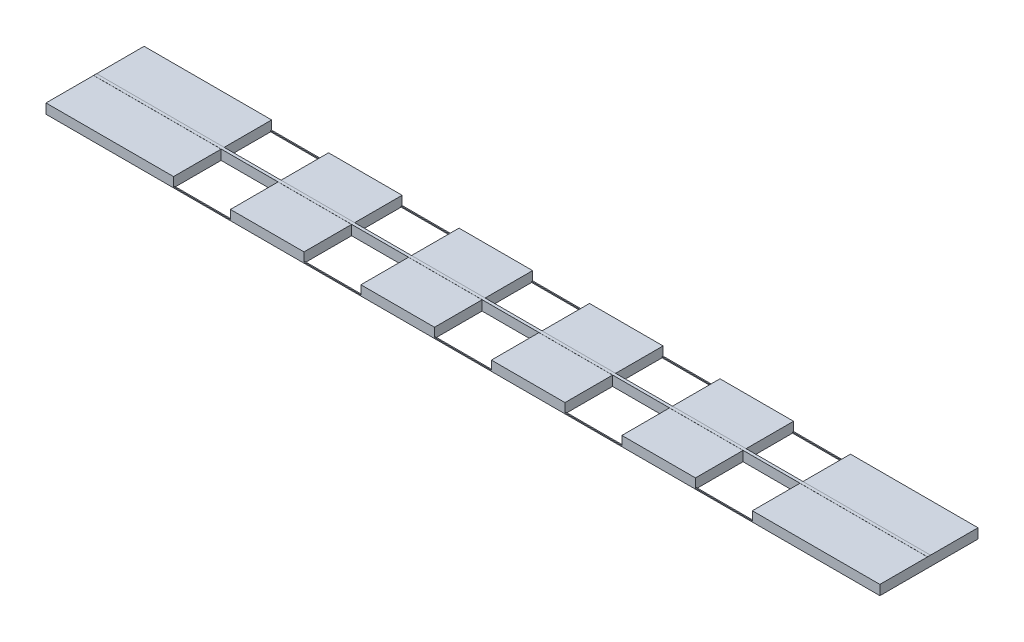
from build123d import *

# Parameters (mm, degrees)
SKETCH1_W           = 8500
SKETCH1_H           = 1000
BOSS_EXTRUDE1_DEPTH = 100
SKETCH2_W           = 8500
SKETCH2_H           = 30
BOSS_EXTRUDE2_DEPTH = 1
SKETCH3_W           = 580
SKETCH3_H           = 475
CUT_EXTRUDE2_DEPTH  = 4281.478945165
SKETCH4_W           = 580
SKETCH4_H           = 10
CUT_EXTRUDE3_DEPTH  = 90


with BuildPart() as part:
    # Sketch1 → Boss-Extrude1 (new body)
    with BuildSketch(Plane(origin=(0, 0, 0), x_dir=(1, 0, 0), z_dir=(0, 1, 0))):
        Rectangle(SKETCH1_W, SKETCH1_H)
    extrude(amount=BOSS_EXTRUDE1_DEPTH)

    # Sketch3 → Cut-Extrude2 (cut, through all)
    with BuildSketch(Plane(origin=(0, 100, 0), x_dir=(1, 0, 0), z_dir=(0, 1, 0))):
        with Locations((-2660, 252.5)):
            Rectangle(SKETCH3_W, SKETCH3_H)
        with Locations((-1330, 252.5)):
            Rectangle(SKETCH3_W, SKETCH3_H)
        with Locations((0, 252.5)):
            Rectangle(SKETCH3_W, SKETCH3_H)
        with Locations((1330, 252.5)):
            Rectangle(SKETCH3_W, SKETCH3_H)
        with Locations((2660, 252.5)):
            Rectangle(SKETCH3_W, SKETCH3_H)
        with Locations((-1330, -252.5)):
            Rectangle(SKETCH3_W, SKETCH3_H)
        with Locations((0, -252.5)):
            Rectangle(SKETCH3_W, SKETCH3_H)
        with Locations((1330, -252.5)):
            Rectangle(SKETCH3_W, SKETCH3_H)
        with Locations((2660, -252.5)):
            Rectangle(SKETCH3_W, SKETCH3_H)
        with Locations((-2660, -252.5)):
            Rectangle(SKETCH3_W, SKETCH3_H)
    extrude(amount=-CUT_EXTRUDE2_DEPTH, mode=Mode.SUBTRACT)

    # Sketch4 → Cut-Extrude3 (cut)
    with BuildSketch(Plane(origin=(0, 100, 0), x_dir=(1, 0, 0), z_dir=(0, 1, 0))):
        with Locations((-2660, 495)):
            Rectangle(SKETCH4_W, SKETCH4_H)
        with Locations((-1330, 495)):
            Rectangle(SKETCH4_W, SKETCH4_H)
        with Locations((0, 495)):
            Rectangle(SKETCH4_W, SKETCH4_H)
        with Locations((1330, 495)):
            Rectangle(SKETCH4_W, SKETCH4_H)
        with Locations((2660, 495)):
            Rectangle(SKETCH4_W, SKETCH4_H)
        with Locations((-1330, -495)):
            Rectangle(SKETCH4_W, SKETCH4_H)
        with Locations((0, -495)):
            Rectangle(SKETCH4_W, SKETCH4_H)
        with Locations((1330, -495)):
            Rectangle(SKETCH4_W, SKETCH4_H)
        with Locations((2660, -495)):
            Rectangle(SKETCH4_W, SKETCH4_H)
        with Locations((-2660, -495)):
            Rectangle(SKETCH4_W, SKETCH4_H)
    extrude(amount=-CUT_EXTRUDE3_DEPTH, mode=Mode.SUBTRACT)


with BuildPart() as body_2:
    # Sketch2 → Boss-Extrude2 (new body)
    with BuildSketch(Plane(origin=(0, 100, 0), x_dir=(1, 0, 0), z_dir=(0, 1, 0))):
        Rectangle(SKETCH2_W, SKETCH2_H)
    extrude(amount=BOSS_EXTRUDE2_DEPTH)


solid = Compound([part.part, body_2.part])
